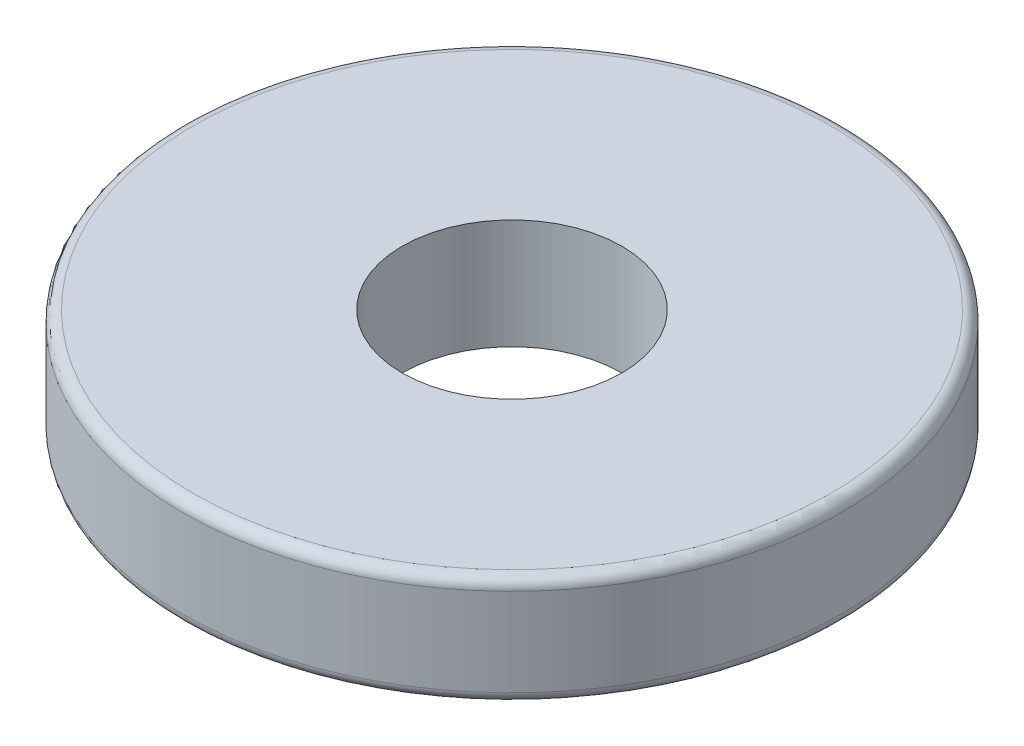
from build123d import *

# Parameters (mm, degrees)
SKIZZE1_R                       = 30
SKIZZE1_R_2                     = 10
AUFSATZ_LINEAR_AUSTRAGEN1_DEPTH = 10
VERRUNDUNG1_R                   = 1


with BuildPart() as part:
    # Skizze1 → Aufsatz-Linear austragen1 (new body)
    with BuildSketch(Plane(origin=(0, 10, 0), x_dir=(1, 0, 0), z_dir=(0, 1, 0))):
        with Locations(Location((10, -10, 0), (0, 0, 270))):
            Circle(SKIZZE1_R)
        with Locations(Location((10, -10, 0), (0, 0, 270))):
            Circle(SKIZZE1_R_2, mode=Mode.SUBTRACT)
    extrude(amount=AUFSATZ_LINEAR_AUSTRAGEN1_DEPTH)

    # Verrundung1
    verrundung1_edges = [part.edges().sort_by_distance(p)[0] for p in [
        (10, 10, -20),
        (10, 20, -20),
    ]]
    fillet(verrundung1_edges, radius=VERRUNDUNG1_R)


solid = part.part
